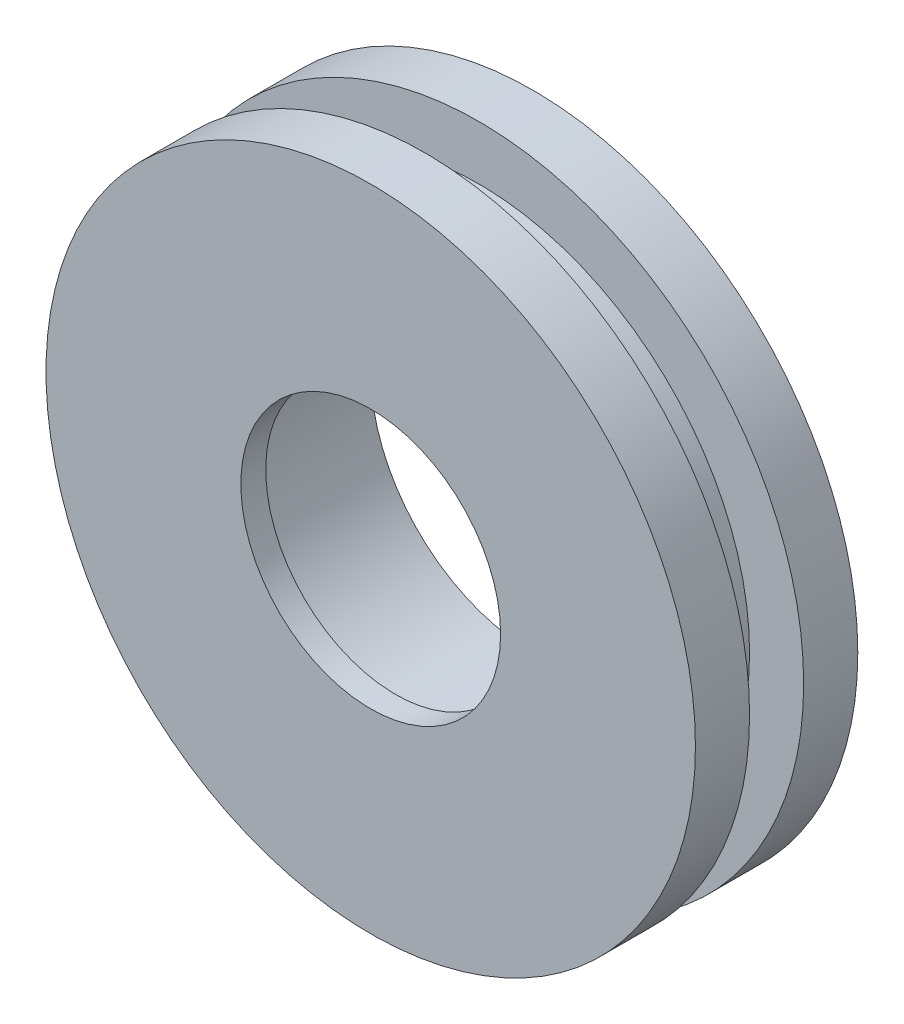
from build123d import *


with BuildPart() as part:
    # Sketch1 → Revolve1 (revolve)
    with BuildSketch(Plane(origin=(0, 0, 0), x_dir=(0, 0, -1), z_dir=(1, 0, 0)), mode=Mode.PRIVATE) as revolve1_sk:
        Polygon((-2.38125, 9.525), (-2.38125, 3.81), (-1.651, 3.81), (-1.651, 4.7625), (2.38125, 4.7625), (2.38125, 9.525), (0.79375, 9.525), (0.79375, 7.9375), (-0.79375, 7.9375), (-0.79375, 9.525), align=None)
    revolve(revolve1_sk.sketch.rotate(Axis((0, 0, 9.165790448), (0, 0, -1)), 90), axis=Axis((0, 0, 9.165790448), (0, 0, -1)))


solid = part.part
